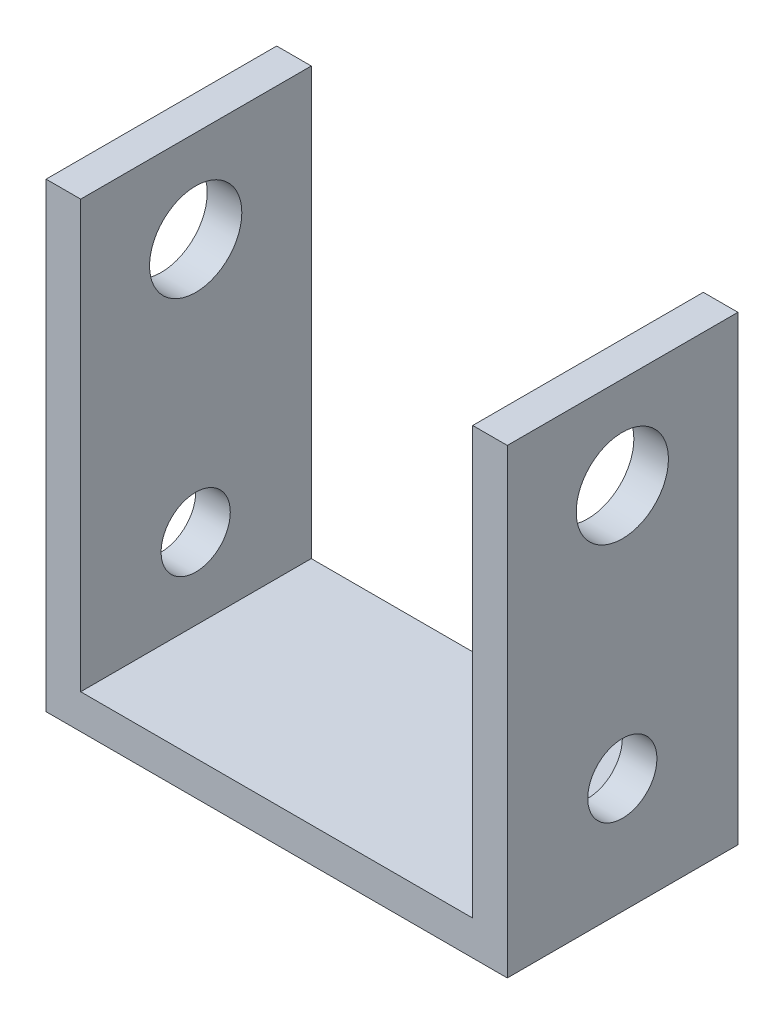
from build123d import *

# Parameters (mm, degrees)
EXTRUSION1_DEPTH = 10
ESQUISSE2_R      = 2
ESQUISSE2_R_2    = 1.5
EXTRUSION2_DEPTH = 30.25417598


with BuildPart() as part:
    # Esquisse1 → Extrusion1 (new body)
    with BuildSketch(Plane.XY):
        Polygon((-26.863107432, 18.862842105), (-26.863107432, -1.137157895), (-6.863107432, -1.137157895), (-6.863107432, 18.862842105), (-8.363107432, 18.862842105), (-8.363107432, 0.362842105), (-25.363107432, 0.362842105), (-25.363107432, 18.862842105), align=None)
    extrude(amount=EXTRUSION1_DEPTH)

    # Esquisse2 → Extrusion2 (cut, through all)
    with BuildSketch(Plane(origin=(-6.863107432, 0, 0), x_dir=(0, 0, -1), z_dir=(1, 0, 0))):
        with Locations((-5.012411511, 14.862842105)):
            Circle(ESQUISSE2_R)
        with Locations((-5.012411511, 3.862842105)):
            Circle(ESQUISSE2_R_2)
    extrude(amount=-EXTRUSION2_DEPTH, mode=Mode.SUBTRACT)


solid = part.part
